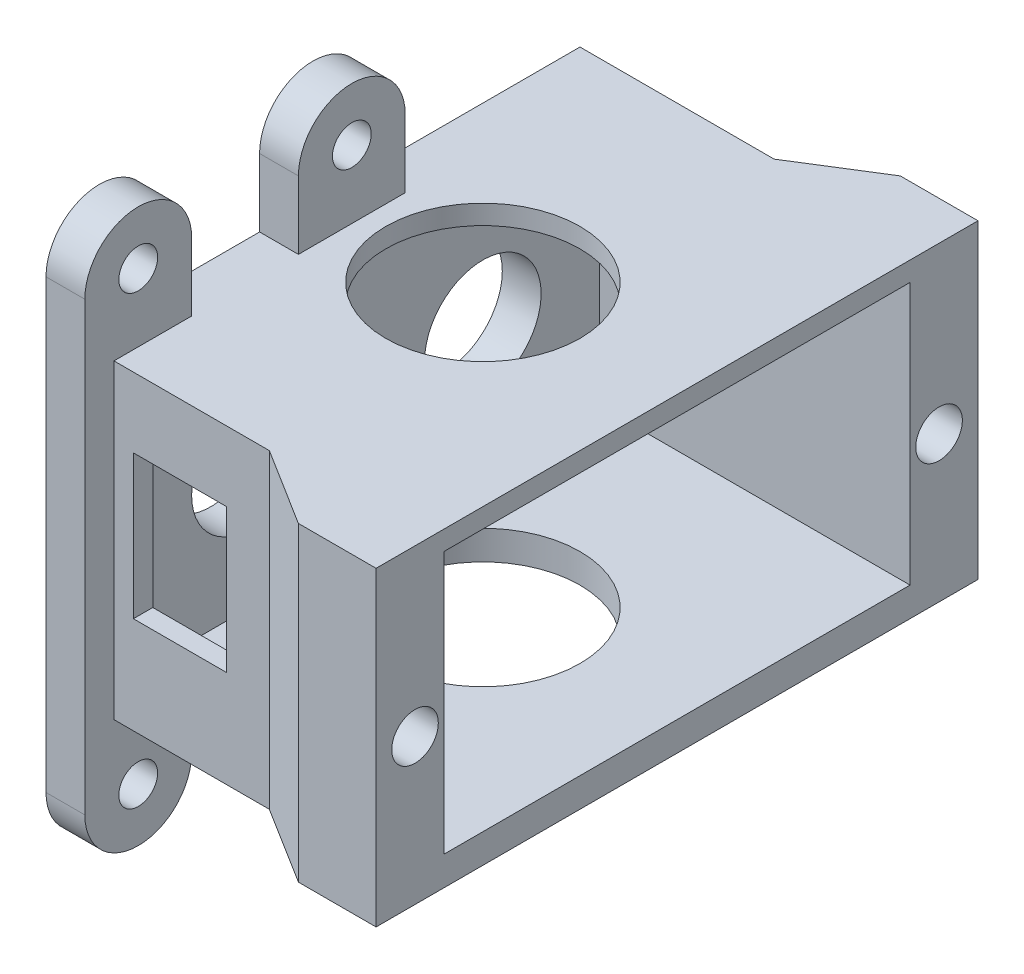
from build123d import *

# Parameters (mm, degrees)
SKETCH2_W             = 130
SKETCH2_H             = 130
BOSS_EXTRUDE2_DEPTH   = 37.5
SKETCH3_W             = 80
SKETCH3_H             = 120
CUT_EXTRUDE1_DEPTH    = 67.5
SKETCH15_W            = 81.593666544
SKETCH15_H            = 171.523851769
CUT_EXTRUDE9_DEPTH    = 119.638105177
SKETCH5_W             = 12.5
SKETCH5_H             = 75
BOSS_EXTRUDE4_DEPTH   = 20
BOSS_EXTRUDE4_2_DEPTH = 20
SKETCH7_R             = 6
CUT_EXTRUDE10_DEPTH   = 20
BOSS_EXTRUDE7_DEPTH   = 5
SKETCH17_W            = 24
SKETCH17_H            = 37
CUT_EXTRUDE11_DEPTH   = 5
SKETCH18_R            = 5
BOSS_EXTRUDE8_DEPTH   = 10
LPATTERN2_COUNT       = 2
LPATTERN2_PITCH       = 55
CUT_EXTRUDE12_REACH   = 152.359
SKETCH20_R            = 25
SKETCH21_R            = 15
CUT_EXTRUDE13_DEPTH   = 10
BOSS_EXTRUDE9_DEPTH   = 80
SKETCH23_W            = 10
SKETCH23_H            = 7.5
BOSS_EXTRUDE10_DEPTH  = 80


with BuildPart() as part:
    # Sketch2 → Boss-Extrude2 (new, symmetric)
    with BuildSketch(Plane(origin=(0, 0, 0), x_dir=(1, 0, 0), z_dir=(0, 1, 0))):
        Rectangle(SKETCH2_W, SKETCH2_H)
    extrude(amount=BOSS_EXTRUDE2_DEPTH, both=True)

    # Sketch3 → Cut-Extrude1 (cut)
    with BuildSketch(Plane(origin=(0, 37.5, 0), x_dir=(1, 0, 0), z_dir=(0, 1, 0))):
        with Locations((25, 0)):
            Rectangle(SKETCH3_W, SKETCH3_H)
    extrude(amount=-CUT_EXTRUDE1_DEPTH, mode=Mode.SUBTRACT)

    # Sketch15 → Cut-Extrude9 (cut, through all)
    with BuildSketch(Plane(origin=(0, 37.5, 0), x_dir=(1, 0, 0), z_dir=(0, 1, 0))):
        with Locations((-65.796833272, -4.787594099)):
            Rectangle(SKETCH15_W, SKETCH15_H)
    extrude(amount=-CUT_EXTRUDE9_DEPTH, mode=Mode.SUBTRACT)


with BuildPart() as body_2:
    # Sketch5 → Boss-Extrude4 (new body)
    with BuildSketch(Plane(origin=(65, 0, 0), x_dir=(0, 0, -1), z_dir=(1, 0, 0))):
        with Locations((-71.25, 0)):
            Rectangle(SKETCH5_W, SKETCH5_H)
    extrude(amount=-BOSS_EXTRUDE4_DEPTH)


with BuildPart() as body_3:
    # Sketch5 → Boss-Extrude4 2 (new body)
    with BuildSketch(Plane(origin=(65, 0, 0), x_dir=(0, 0, -1), z_dir=(1, 0, 0))):
        with Locations((71.25, 0)):
            Rectangle(SKETCH5_W, SKETCH5_H)
    extrude(amount=-BOSS_EXTRUDE4_2_DEPTH)


with BuildPart() as cut_extrude10_tool:
    # Sketch7 → Cut-Extrude10 (new body)
    with BuildSketch(Plane(origin=(65, 0, 0), x_dir=(0, 0, -1), z_dir=(1, 0, 0))):
        with Locations((-67.475, 0)):
            Circle(SKETCH7_R)
        with Locations((67.475, 0)):
            Circle(SKETCH7_R)
    extrude(amount=-CUT_EXTRUDE10_DEPTH)


with BuildPart() as part_1:
    add(part.part)

    # Cut-Extrude10: cut by cut_extrude10_tool
    add(cut_extrude10_tool.part, mode=Mode.SUBTRACT)



with BuildPart() as body_2_1:
    add(body_2.part)

    # Cut-Extrude10: cut by cut_extrude10_tool
    add(cut_extrude10_tool.part, mode=Mode.SUBTRACT)


with BuildPart() as body_3_1:
    add(body_3.part)

    # Cut-Extrude10: cut by cut_extrude10_tool
    add(cut_extrude10_tool.part, mode=Mode.SUBTRACT)


with BuildPart() as part_2:
    add(part_1.part)

    add(body_2_1.part)  # Boss-Extrude7 merges body 2

    add(body_3_1.part)  # Boss-Extrude7 merges body 3
    # Sketch16 → Boss-Extrude7 (add)
    with BuildSketch(Plane(origin=(0, 37.5, 0), x_dir=(1, 0, 0), z_dir=(0, 1, 0))):
        Polygon((-25, 65), (-25, -65), (45, -65), (45, -77.5), (65, -77.5), (65, 77.5), (45, 77.5), (45, 65), align=None)
    extrude(amount=BOSS_EXTRUDE7_DEPTH)

    # Sketch17 → Cut-Extrude11 (cut)
    with BuildSketch(Plane.XY.offset(65)):
        with Locations((2, 6)):
            Rectangle(SKETCH17_W, SKETCH17_H)
    extrude(amount=-CUT_EXTRUDE11_DEPTH, mode=Mode.SUBTRACT)

    # Sketch18 → Boss-Extrude8 (add)
    # profile 1 of 2: a face of its own
    with BuildSketch(Plane.ZY.offset(25)):
        with BuildLine():
            Line((45, 42.5), (45, 60))
            ThreePointArc((45, 60), (58.75, 73.75), (72.5, 60))
            Line((72.5, 60), (72.5, 42.5))
            Line((72.5, 42.5), (45, 42.5))
        make_face()
        with Locations((58.75, 60)):
            Circle(SKETCH18_R, mode=Mode.SUBTRACT)
    # profile 2 of 2: a face of its own
    with BuildSketch(Plane.ZY.offset(25)):
        with BuildLine():
            Line((72.5, -37.5), (45, -37.5))
            Line((45, -37.5), (45, -55))
            ThreePointArc((45, -55), (58.75, -68.75), (72.5, -55))
            Line((72.5, -55), (72.5, -37.5))
        make_face()
        with Locations(Location((58.75, -55, 0), (0, 0, 180))):
            Circle(SKETCH18_R, mode=Mode.SUBTRACT)
    boss_extrude8 = extrude(amount=-BOSS_EXTRUDE8_DEPTH)

    # LPattern2: Boss-Extrude8 ×2
    with Locations(*[(0, 0, -i * LPATTERN2_PITCH) for i in range(1, LPATTERN2_COUNT)]):
        add(boss_extrude8)

    # Cut-Extrude12: up to this face of the body (flat: up to its plane)
    cut_extrude12_end = Plane(part_2.part.faces().sort_by_distance((23.113006397, -37.5, -1.026119403))[0])
    # Sketch20 → Cut-Extrude12 (cut, up to the picked face)
    with BuildSketch(Plane(origin=(0, 42.5, 0), x_dir=(1, 0, 0), z_dir=(0, 1, 0)), mode=Mode.PRIVATE) as cut_extrude12_sk1:
        with Locations(Location((15, 0, 0), (0, 0, 90))):
            Circle(SKETCH20_R)
    cut_extrude12_tool1 = split(extrude(cut_extrude12_sk1.sketch, amount=-CUT_EXTRUDE12_REACH, mode=Mode.PRIVATE), bisect_by=cut_extrude12_end, keep=Keep.BOTH, mode=Mode.PRIVATE)
    add(cut_extrude12_tool1.solids().sort_by(Axis((15, 42.5, 0), (0, -1, 0)))[0], mode=Mode.SUBTRACT)

    # Sketch21 → Cut-Extrude13 (cut)
    with BuildSketch(Plane.ZY.offset(25)):
        with Locations((30, 2.5)):
            Circle(SKETCH21_R)
        with Locations((-30, 2.5)):
            Circle(SKETCH21_R)
    extrude(amount=-CUT_EXTRUDE13_DEPTH, mode=Mode.SUBTRACT)

    # Sketch22 → Boss-Extrude9 (add)
    with BuildSketch(Plane(origin=(0, 42.5, 0), x_dir=(1, 0, 0), z_dir=(0, 1, 0))):
        Polygon((45, -65), (45, -77.5), (25, -65), align=None)
        Polygon((45, 77.5), (45, 65), (25, 65), align=None)
    extrude(amount=-BOSS_EXTRUDE9_DEPTH)

    # Sketch23 → Boss-Extrude10 (add)
    with BuildSketch(Plane(origin=(0, 42.5, 0), x_dir=(-1, 0, 0), z_dir=(0, -1, 0))):
        with Locations((20, -68.75)):
            Rectangle(SKETCH23_W, SKETCH23_H)
    extrude(amount=BOSS_EXTRUDE10_DEPTH)


solid = part_2.part
